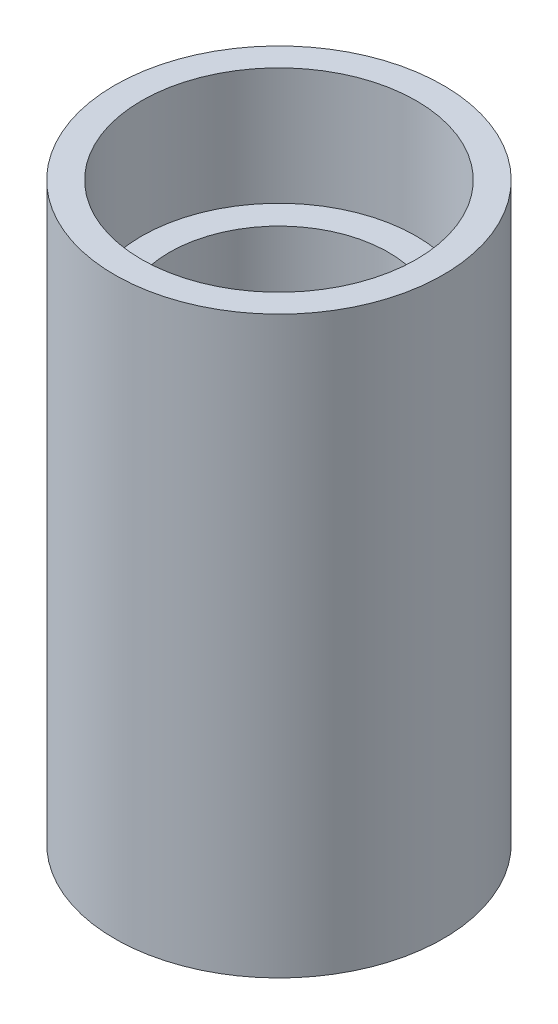
from build123d import *


with BuildPart() as part:
    # Sketch1 → Revolve1 (revolve)
    with BuildSketch(Plane.XY, mode=Mode.PRIVATE) as revolve1_sk:
        Polygon((25.4, 0), (38.1, 0), (38.1, 133.35), (31.877, 133.35), (31.877, 106.1466), (25.4, 106.1466), align=None)
    revolve(revolve1_sk.sketch.rotate(Axis((0, 55.746772516, 0), (0, -1, 0)), 180), axis=Axis((0, 55.746772516, 0), (0, -1, 0)))


solid = part.part
